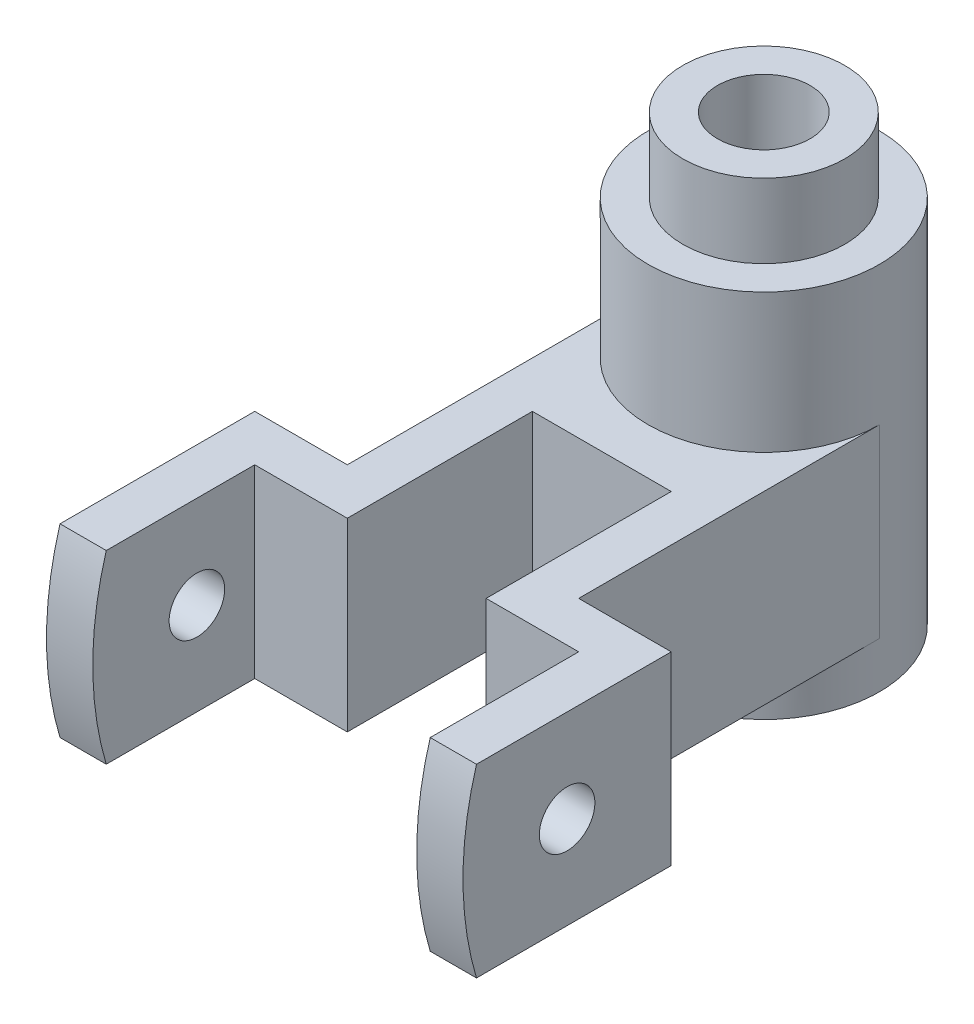
from build123d import *

# Parameters (mm, degrees)
SKETCH1_R           = 25
BOSS_EXTRUDE1_DEPTH = 80
SKETCH2_R           = 17.5
BOSS_EXTRUDE2_DEPTH = 16
SKETCH3_R           = 10
CUT_EXTRUDE1_DEPTH  = 144
BOSS_EXTRUDE3_DEPTH = 40
SKETCH5_W           = 30
SKETCH5_H           = 40
SKETCH5_W_2         = 20
SKETCH5_W_3         = 10
BOSS_EXTRUDE4_DEPTH = 10
SKETCH6_W           = 10
SKETCH6_H           = 40
BOSS_EXTRUDE5_DEPTH = 35
CUT_EXTRUDE2_DEPTH  = 35


with BuildPart() as part:
    # Sketch1 → Boss-Extrude1 (new body)
    with BuildSketch(Plane(origin=(0, 0, 0), x_dir=(1, 0, 0), z_dir=(0, 1, 0))):
        with Locations(Location((0, 0, 0), (0, 0, 270))):
            Circle(SKETCH1_R)
    extrude(amount=BOSS_EXTRUDE1_DEPTH)

    # Sketch2 → Boss-Extrude2 (add)
    with BuildSketch(Plane(origin=(0, 80, 0), x_dir=(1, 0, 0), z_dir=(0, 1, 0))):
        with Locations(Location((0, 0, 0), (0, 0, 270))):
            Circle(SKETCH2_R)
    extrude(amount=BOSS_EXTRUDE2_DEPTH)

    # Sketch3 → Cut-Extrude1 (cut)
    with BuildSketch(Plane(origin=(0, 96, 0), x_dir=(1, 0, 0), z_dir=(0, 1, 0))):
        with Locations(Location((0, 0, 0), (0, 0, 270))):
            Circle(SKETCH3_R)
    extrude(amount=-CUT_EXTRUDE1_DEPTH, mode=Mode.SUBTRACT)

    # Sketch4 → Boss-Extrude3 (add)
    with BuildSketch(Plane(origin=(0, 50, 0), x_dir=(1, 0, 0), z_dir=(0, 1, 0))):
        Polygon((0, -35), (0, 0), (-25, 0), (-25, -65), (-15, -65), (-15, -35), align=None)
        Polygon((25, 0), (0, 0), (0, -35), (15, -35), (15, -65), (25, -65), align=None)
    extrude(amount=-BOSS_EXTRUDE3_DEPTH)

    # Sketch5 → Boss-Extrude4 (add)
    with BuildSketch(Plane.XY.offset(65)):
        with Locations((-30, 30)):
            Rectangle(SKETCH5_W, SKETCH5_H)
        with Locations((35, 30)):
            Rectangle(SKETCH5_W_2, SKETCH5_H)
        with Locations((20, 30)):
            Rectangle(SKETCH5_W_3, SKETCH5_H)
    extrude(amount=BOSS_EXTRUDE4_DEPTH)

    # Sketch6 → Boss-Extrude5 (add)
    with BuildSketch(Plane.XY.offset(75)):
        with Locations((-40, 30)):
            Rectangle(SKETCH6_W, SKETCH6_H)
    boss_extrude5 = extrude(amount=BOSS_EXTRUDE5_DEPTH)

    # Sketch7 → Cut-Extrude2 (cut)
    with BuildSketch(Plane(origin=(-35, 0, 0), x_dir=(0, 0, -1), z_dir=(1, 0, 0))):
        with BuildLine():
            Line((-107.082039325, 50), (-110, 50))
            Line((-110, 50), (-110, 30))
            ThreePointArc((-110, 30), (-109.266668581, 40.10587075), (-107.082039325, 50))
        make_face()
        with BuildLine():
            ThreePointArc((-107.082039325, 10), (-109.266668581, 19.89412925), (-110, 30))
            Line((-110, 30), (-110, 10))
            Line((-110, 10), (-107.082039325, 10))
        make_face()
        with BuildLine():
            ThreePointArc((-81.5, 30), (-87.5, 36), (-93.5, 30))
            Line((-93.5, 30), (-87.5, 30))
            Line((-87.5, 30), (-81.5, 30))
        make_face()
        with BuildLine():
            Line((-87.5, 30), (-93.5, 30))
            ThreePointArc((-93.5, 30), (-87.5, 24), (-81.5, 30))
            Line((-81.5, 30), (-87.5, 30))
        make_face()
    cut_extrude2 = extrude(amount=-CUT_EXTRUDE2_DEPTH, mode=Mode.SUBTRACT)

    # Mirror1: Boss-Extrude5, Cut-Extrude2 across plane
    add(boss_extrude5.mirror(Plane(origin=(0, 0, 0), x_dir=(0, 0, 1), z_dir=(1, 0, 0))))
    add(cut_extrude2.mirror(Plane(origin=(0, 0, 0), x_dir=(0, 0, 1), z_dir=(1, 0, 0))), mode=Mode.SUBTRACT)


solid = part.part
